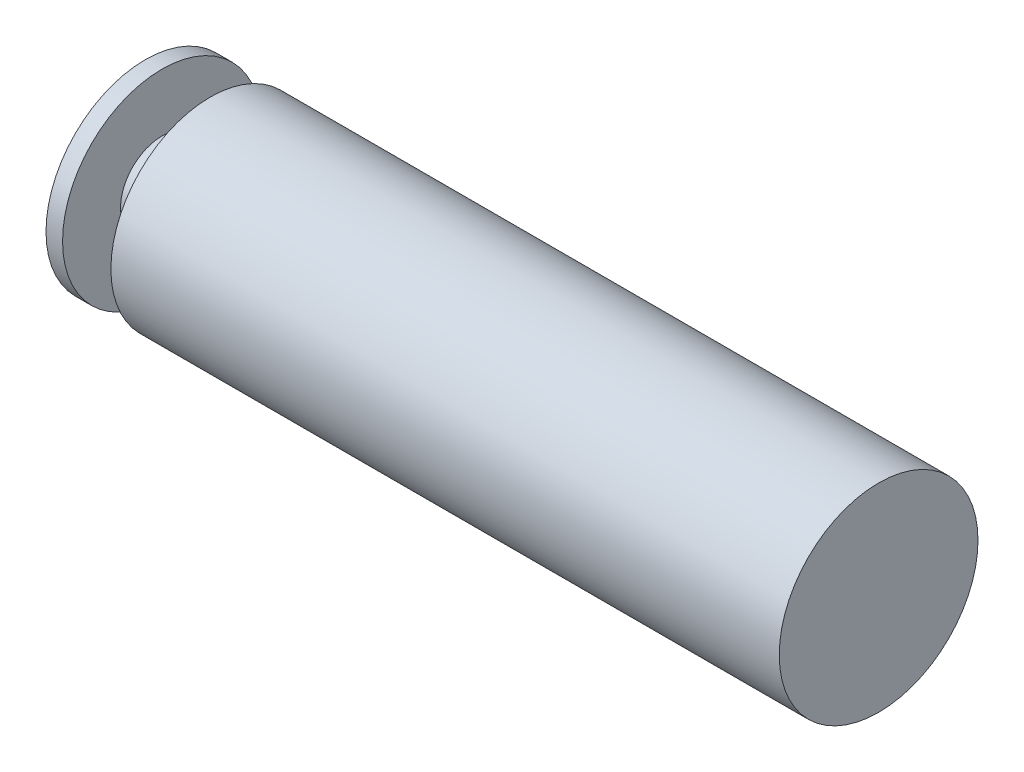
from build123d import *


with BuildPart() as part:
    # Sketch1 → Revolve1 (revolve)
    with BuildSketch(Plane.XY, mode=Mode.PRIVATE) as revolve1_sk:
        Polygon((0, 0), (0, 12), (2, 12), (2, 5), (7.8346047, 5), (7.8346047, 12), (88.546636387, 12), (88.546636387, 0), align=None)
    revolve(revolve1_sk.sketch.rotate(Axis((88.546636387, 0, 0), (-1, 0, 0)), 90), axis=Axis((88.546636387, 0, 0), (-1, 0, 0)))


solid = part.part
